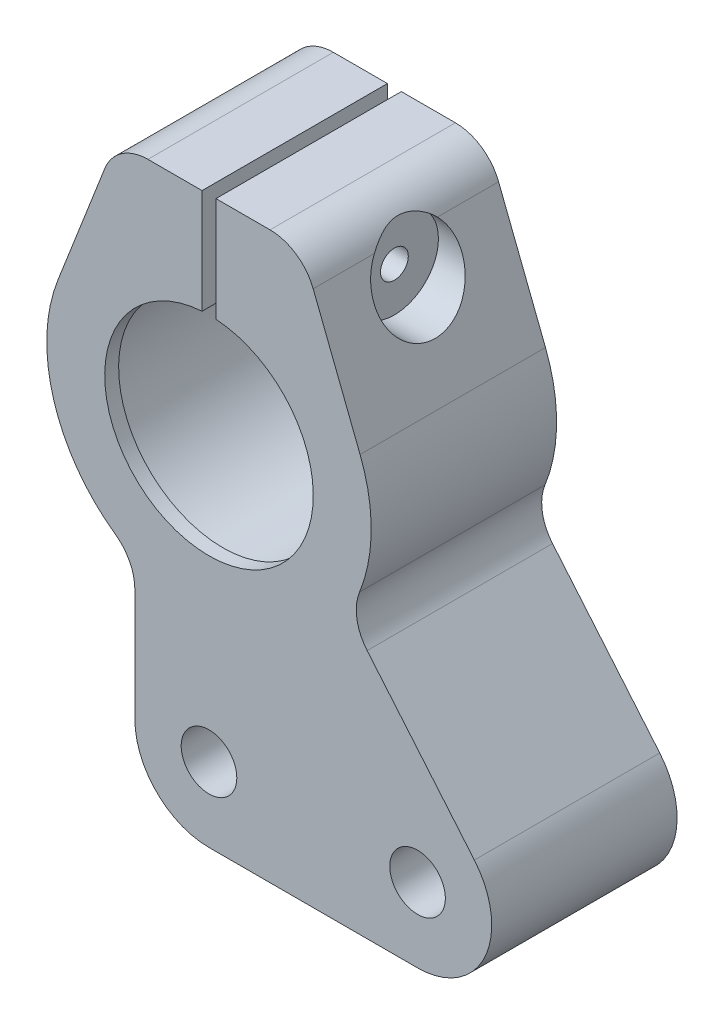
from build123d import *

# Parameters (mm, degrees)
SKETCH1_R           = 6
BOSS_EXTRUDE3_DEPTH = 40
FILLET2_R           = 10
SKETCH5_R           = 9.5
CUT_EXTRUDE1_DEPTH  = 10
SKETCH6_R           = 3
CUT_EXTRUDE2_DEPTH  = 21.5
BOSS_EXTRUDE4_START = -3
BOSS_EXTRUDE4_DEPTH = 3


with BuildPart() as part:
    # Sketch1 → Boss-Extrude3 (new body)
    with BuildSketch(Plane.XY):
        with BuildLine():
            Line((-16, -31.128764833), (-16, -61))
            ThreePointArc((-16, -61), (-11.313708499, -72.313708499), (0, -77))
            Line((0, -77), (45, -77))
            ThreePointArc((45, -77), (59.500924593, -67.761892188), (57.25671109, -50.715398245))
            Line((57.25671109, -50.715398245), (29.928255065, -18.146612597))
            ThreePointArc((29.928255065, -18.146612597), (34.869538701, -3.019150675), (32.601897088, 12.732490183))
            Line((32.601897088, 12.732490183), (20, 45))
            Line((20, 45), (1.5, 45))
            Line((1.5, 45), (1.5, 25.205406166))
            ThreePointArc((1.5, 25.205406166), (0, -25.25), (-1.5, 25.205406166))
            Line((-1.5, 25.205406166), (-1.5, 45))
            Line((-1.5, 45), (-20, 45))
            Line((-20, 45), (-32.601897088, 12.732490183))
            ThreePointArc((-32.601897088, 12.732490183), (-32.733599298, -12.389974858), (-16, -31.128764833))
        make_face()
        with Locations((0, -61)):
            Circle(SKETCH1_R, mode=Mode.SUBTRACT)
        with Locations((45, -61)):
            Circle(SKETCH1_R, mode=Mode.SUBTRACT)
    extrude(amount=BOSS_EXTRUDE3_DEPTH)

    # Fillet2
    fillet2_edges = [part.edges().sort_by_distance(p)[0] for p in [
        (-20, 45, 20),
        (20, 45, 20),
        (29.928255065, -18.146612597, 20),
        (-16, -31.128764833, 20),
    ]]
    fillet(fillet2_edges, radius=FILLET2_R)

    # Sketch5 → Cut-Extrude1 (cut)
    with BuildSketch(Plane(origin=(-20, 0, 0), x_dir=(0, 0, -1), z_dir=(1, 0, 0))):
        with Locations((-20, 32)):
            Circle(SKETCH5_R)
    cut_extrude1 = extrude(amount=-CUT_EXTRUDE1_DEPTH, mode=Mode.SUBTRACT)

    # Sketch6 → Cut-Extrude2 (cut)
    with BuildSketch(Plane.ZY.offset(20)):
        with Locations((20, 32)):
            Circle(SKETCH6_R)
    cut_extrude2 = extrude(amount=-CUT_EXTRUDE2_DEPTH, mode=Mode.SUBTRACT)

    # Mirror3: Cut-Extrude1, Cut-Extrude2 across plane
    add(cut_extrude1.mirror(Plane(origin=(0, 0, 0), x_dir=(0, 0, 1), z_dir=(1, 0, 0))), mode=Mode.SUBTRACT)
    add(cut_extrude2.mirror(Plane(origin=(0, 0, 0), x_dir=(0, 0, 1), z_dir=(1, 0, 0))), mode=Mode.SUBTRACT)

    # Sketch7 → Boss-Extrude4 (add)
    with BuildSketch(Plane.XY.offset(40).offset(BOSS_EXTRUDE4_START)):
        with BuildLine():
            ThreePointArc((22.5, 0), (-15.370426149, -16.431676725), (-1.5, 22.449944321))
            Line((-1.5, 22.449944321), (-1.5, 25.205406166))
            ThreePointArc((-1.5, 25.205406166), (-17.315996939, -18.377125727), (25.25, 0))
            ThreePointArc((25.25, 0), (18.377125727, 17.315996939), (1.5, 25.205406166))
            Line((1.5, 25.205406166), (1.5, 22.449944321))
            ThreePointArc((1.5, 22.449944321), (16.431676725, 15.370426149), (22.5, 0))
        make_face()
    extrude(amount=BOSS_EXTRUDE4_DEPTH)


solid = part.part
